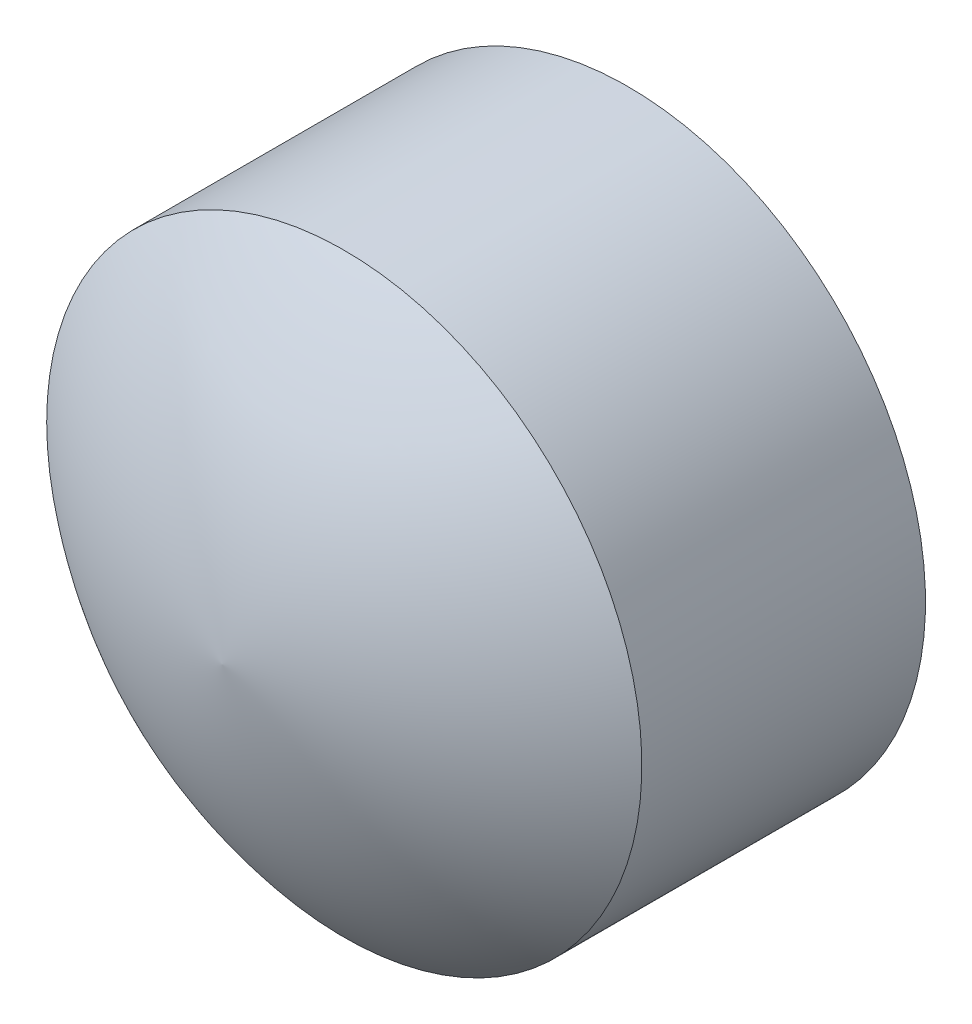
from build123d import *


with BuildPart() as part:
    # Sketch1 → Revolve1 (revolve)
    with BuildSketch(Plane(origin=(0, 0, 0), x_dir=(1, 0, 0), z_dir=(0, 1, 0)), mode=Mode.PRIVATE) as revolve1_sk:
        with BuildLine():
            Line((0, 0), (6, 0))
            Line((6, 0), (6, 10))
            Line((6, 10), (11, 10))
            Line((11, 10), (11, -0.485124968))
            ThreePointArc((11, -0.485124968), (5.843284852, -3.578938539), (0, -5))
            Line((0, -5), (0, 0))
        make_face()
    revolve(revolve1_sk.sketch.rotate(Axis((0, 0, 0), (0, 0, 1)), 180), axis=Axis((0, 0, 0), (0, 0, 1)))


solid = part.part
